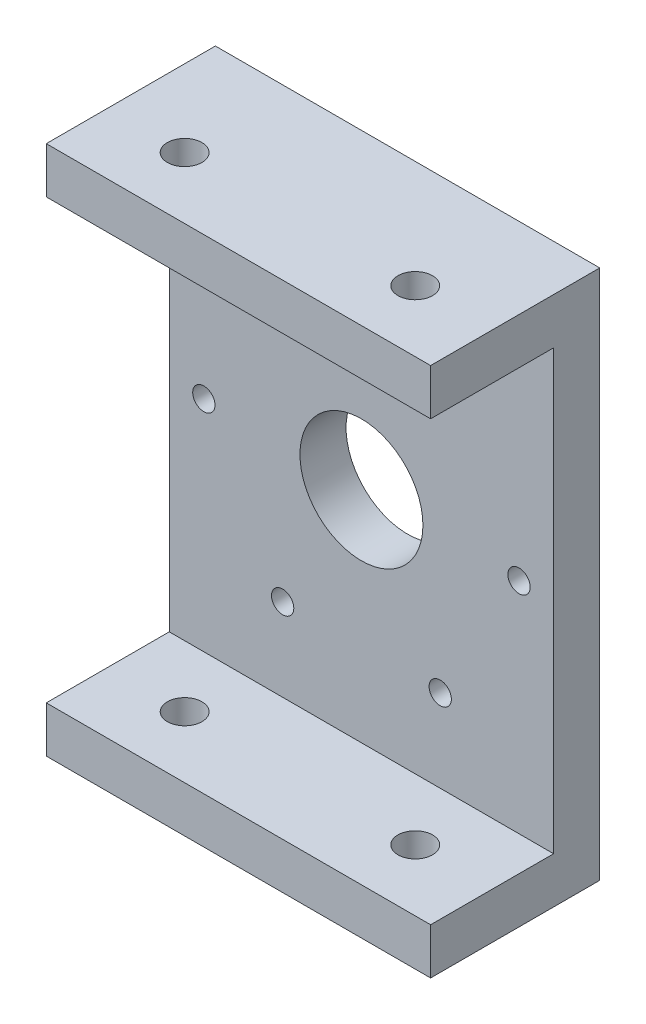
from build123d import *

# Parameters (mm, degrees)
REPISA_START                   = 520
SK_REPISA_W                    = 50
SK_REPISA_H                    = 69
REPISA_DEPTH                   = 6
CENTRO_MOTOR_START             = 520
SK_CENTRO_MOTOR_R              = 8
CENTRO_MOTOR_DEPTH             = 6
PASANTES_M2_5_ESTATOR_J6_START = 520
SK_PASANTES_M2_5_ESTATOR_J6_R  = 1.45
PASANTES_M2_5_ESTATOR_J6_DEPTH = 6
PESTANAS_START                 = 526
SK_PESTANAS_W                  = 50
SK_PESTANAS_H                  = 6
PESTANAS_DEPTH                 = 16
PASANTES_M4_PESTANAS_START     = -34.5
SK_PASANTES_M4_PESTANAS_R      = 2.25
PASANTES_M4_PESTANAS_DEPTH     = 69


with BuildPart() as part:
    # Sk_Repisa → Repisa (new body)
    with BuildSketch(Plane.XY.offset(REPISA_START)):
        Rectangle(SK_REPISA_W, SK_REPISA_H)
    extrude(amount=REPISA_DEPTH)

    # Sk_Centro_motor → Centro_motor (cut)
    with BuildSketch(Plane.XY.offset(CENTRO_MOTOR_START)):
        Circle(SK_CENTRO_MOTOR_R)
    extrude(amount=CENTRO_MOTOR_DEPTH, mode=Mode.SUBTRACT)

    # Sk_Pasantes_M2-5_estator_J6 → Pasantes_M2-5_estator_J6 (cut)
    with BuildSketch(Plane.XY.offset(PASANTES_M2_5_ESTATOR_J6_START)):
        with Locations((20.5, 0)):
            Circle(SK_PASANTES_M2_5_ESTATOR_J6_R)
        with Locations((10.25, 17.753520778)):
            Circle(SK_PASANTES_M2_5_ESTATOR_J6_R)
        with Locations((-10.25, 17.753520778)):
            Circle(SK_PASANTES_M2_5_ESTATOR_J6_R)
        with Locations((-20.5, 0)):
            Circle(SK_PASANTES_M2_5_ESTATOR_J6_R)
        with Locations((-10.25, -17.753520778)):
            Circle(SK_PASANTES_M2_5_ESTATOR_J6_R)
        with Locations((10.25, -17.753520778)):
            Circle(SK_PASANTES_M2_5_ESTATOR_J6_R)
    extrude(amount=PASANTES_M2_5_ESTATOR_J6_DEPTH, mode=Mode.SUBTRACT)

    # Sk_Pestanas → Pestanas (add)
    with BuildSketch(Plane.XY.offset(PESTANAS_START)):
        with Locations((0, 31.5)):
            Rectangle(SK_PESTANAS_W, SK_PESTANAS_H)
        with Locations((0, -31.5)):
            Rectangle(SK_PESTANAS_W, SK_PESTANAS_H)
    extrude(amount=PESTANAS_DEPTH)

    # Sk_Pasantes_M4_pestanas → Pasantes_M4_pestanas (cut)
    with BuildSketch(Plane(origin=(0, 0, 0), x_dir=(1, 0, 0), z_dir=(0, 1, 0)).offset(PASANTES_M4_PESTANAS_START)):
        with Locations(Location((-15, -534, 0), (0, 0, 270))):
            Circle(SK_PASANTES_M4_PESTANAS_R)
        with Locations(Location((15, -534, 0), (0, 0, 270))):
            Circle(SK_PASANTES_M4_PESTANAS_R)
    extrude(amount=PASANTES_M4_PESTANAS_DEPTH, mode=Mode.SUBTRACT)


solid = part.part
